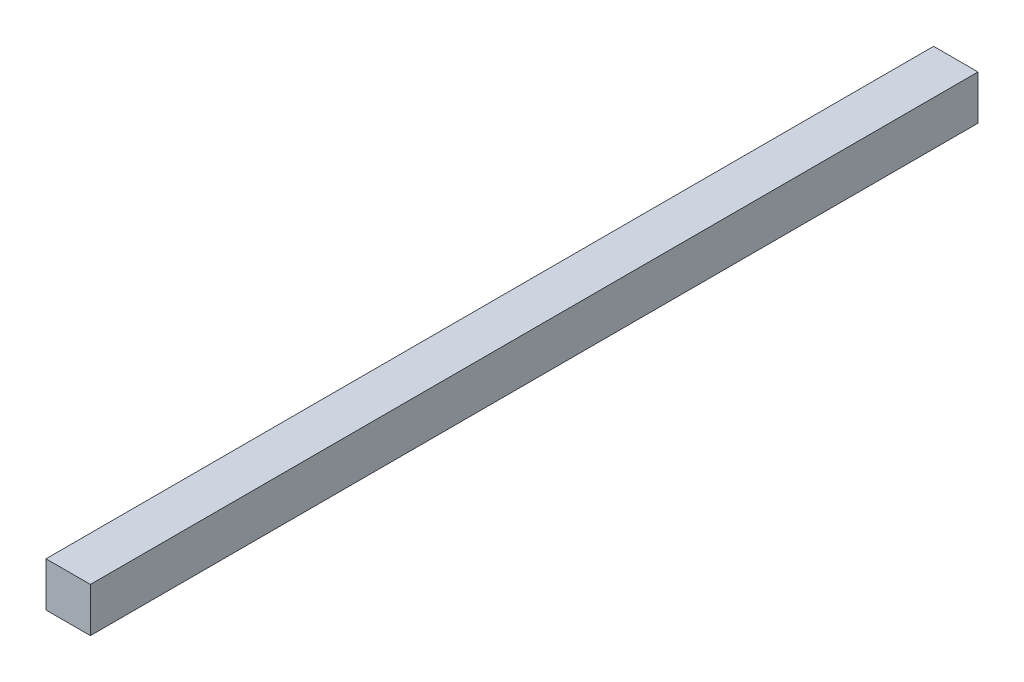
from build123d import *

# Parameters (mm, degrees)
SKETCH_1_W      = 30
SKETCH_1_H      = 30
EXTRUDE_1_DEPTH = 600


with BuildPart() as part:
    # 草图1 → 凸台-拉伸1 (new body)
    with BuildSketch(Plane.XY):
        Rectangle(SKETCH_1_W, SKETCH_1_H)
    extrude(amount=EXTRUDE_1_DEPTH)


solid = part.part
